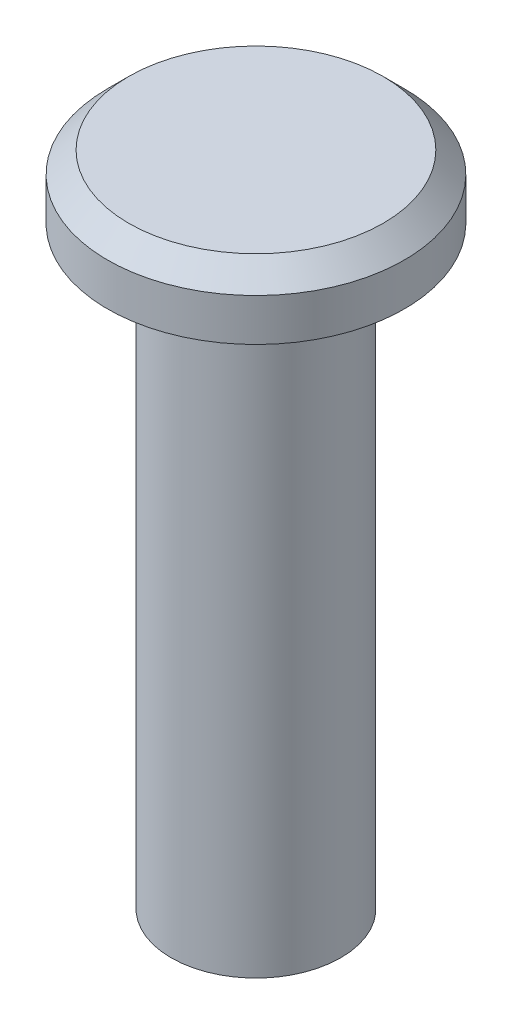
from build123d import *


with BuildPart() as part:
    # Sketch1 → Revolve1 (revolve)
    with BuildSketch(Plane.XY, mode=Mode.PRIVATE) as revolve1_sk:
        Polygon((0, 0), (4, 0), (4, 28), (7, 28), (7, 30), (6, 31), (0, 31), align=None)
    revolve(revolve1_sk.sketch.rotate(Axis((0, 33.604972013, 0), (0, -1, 0)), 180), axis=Axis((0, 33.604972013, 0), (0, -1, 0)))


solid = part.part
